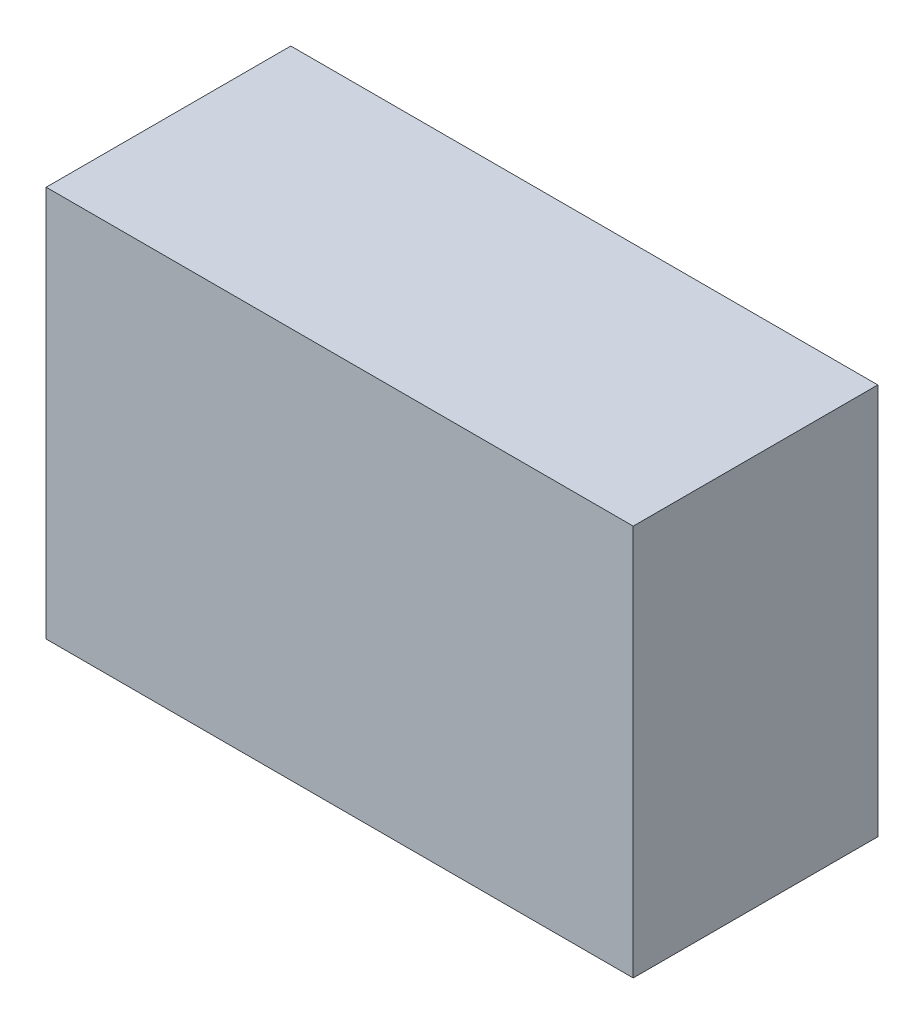
from build123d import *

# Parameters (mm, degrees)
SKETCH_1_W        = 12
SKETCH_1_H        = 8
CABLE_CLAMP_DEPTH = 5


with BuildPart() as part:
    # 草图1 → Cable_Clamp (new body)
    with BuildSketch(Plane.XY):
        with Locations((6, 4)):
            Rectangle(SKETCH_1_W, SKETCH_1_H)
    extrude(amount=CABLE_CLAMP_DEPTH)


solid = part.part
